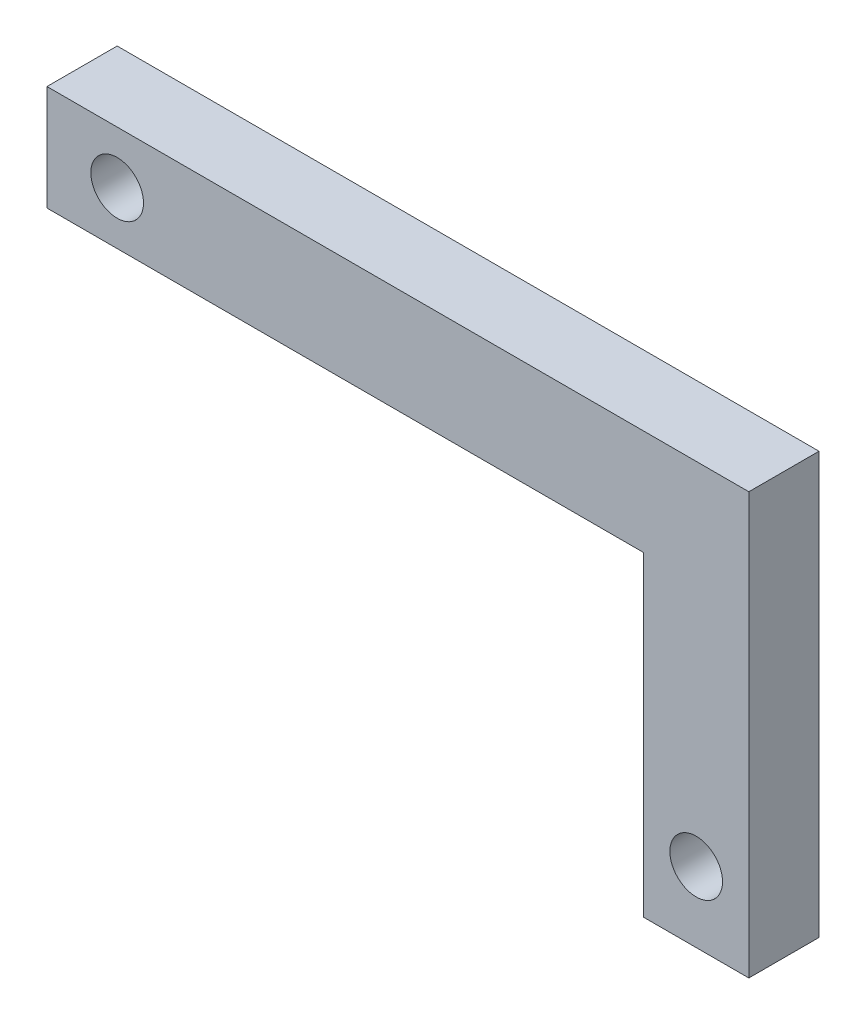
from build123d import *

# Parameters (mm, degrees)
SKETCH1_W           = 254
SKETCH1_H           = 38.1
SKETCH1_W_2         = 38.1
SKETCH1_H_2         = 114.3
BOSS_EXTRUDE1_DEPTH = 25.4
SKETCH2_R           = 9.525
CUT_EXTRUDE1_DEPTH  = 280.688487428
SKETCH3_R           = 9.525
CUT_EXTRUDE2_DEPTH  = 280.688487428


with BuildPart() as part:
    # Sketch1 → Boss-Extrude1 (new body)
    with BuildSketch(Plane.XY):
        with Locations((127, 19.05)):
            Rectangle(SKETCH1_W, SKETCH1_H)
        with Locations((234.95, -57.15)):
            Rectangle(SKETCH1_W_2, SKETCH1_H_2)
    extrude(amount=BOSS_EXTRUDE1_DEPTH)

    # Sketch2 → Cut-Extrude1 (cut, through all)
    with BuildSketch(Plane.XY.offset(25.4)):
        with Locations((25.4, 19.05)):
            Circle(SKETCH2_R)
    extrude(amount=-CUT_EXTRUDE1_DEPTH, mode=Mode.SUBTRACT)

    # Sketch3 → Cut-Extrude2 (cut, through all)
    with BuildSketch(Plane.XY.offset(25.4)):
        with Locations((234.95, -88.9)):
            Circle(SKETCH3_R)
    extrude(amount=-CUT_EXTRUDE2_DEPTH, mode=Mode.SUBTRACT)


solid = part.part
